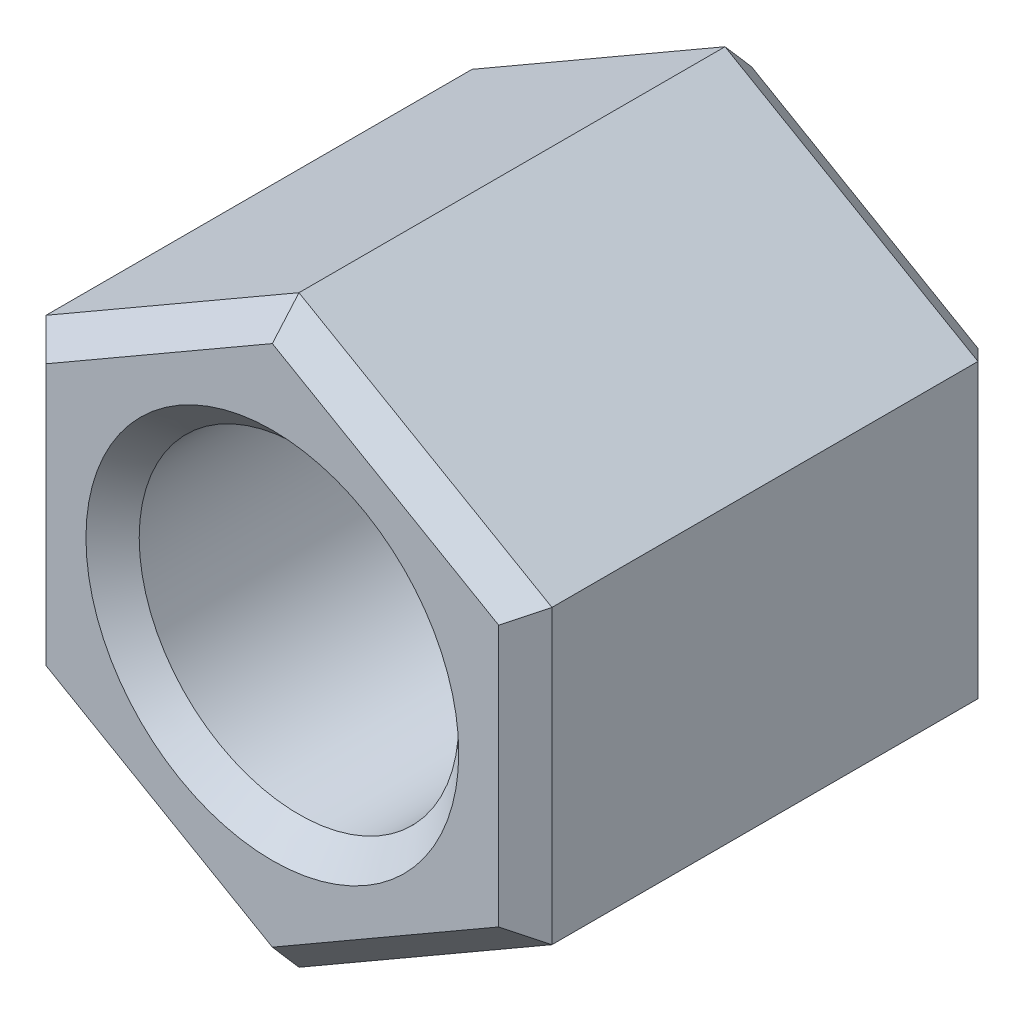
from build123d import *

# Parameters (mm, degrees)
ESQUISSE1_R        = 6
BOSS_EXTRU_1_DEPTH = 18
CHANFREIN1_SIZE    = 1


with BuildPart() as part:
    # Esquisse1 → Boss.-Extru.1 (new body)
    with BuildSketch(Plane.XY):
        Polygon((9.5, -5.484827557), (9.5, 5.484827557), (0, 10.969655115), (-9.5, 5.484827557), (-9.5, -5.484827557), (0, -10.969655115), align=None)
        Circle(ESQUISSE1_R, mode=Mode.SUBTRACT)
    extrude(amount=BOSS_EXTRU_1_DEPTH)

    # Chanfrein1
    chanfrein1_edges = [part.edges().sort_by_distance(p)[0] for p in [
        (-4.75, -8.227241336, 18),
        (4.75, -8.227241336, 18),
        (9.5, 0, 18),
        (-6, 0, 0),
        (-6, 0, 18),
        (4.75, 8.227241336, 18),
        (-4.75, 8.227241336, 18),
        (4.75, 8.227241336, 0),
        (9.5, 0, 0),
        (4.75, -8.227241336, 0),
        (-9.5, 0, 18),
        (-4.75, -8.227241336, 0),
        (-9.5, 0, 0),
        (-4.75, 8.227241336, 0),
    ]]
    chamfer(chanfrein1_edges, length=CHANFREIN1_SIZE)


solid = part.part
